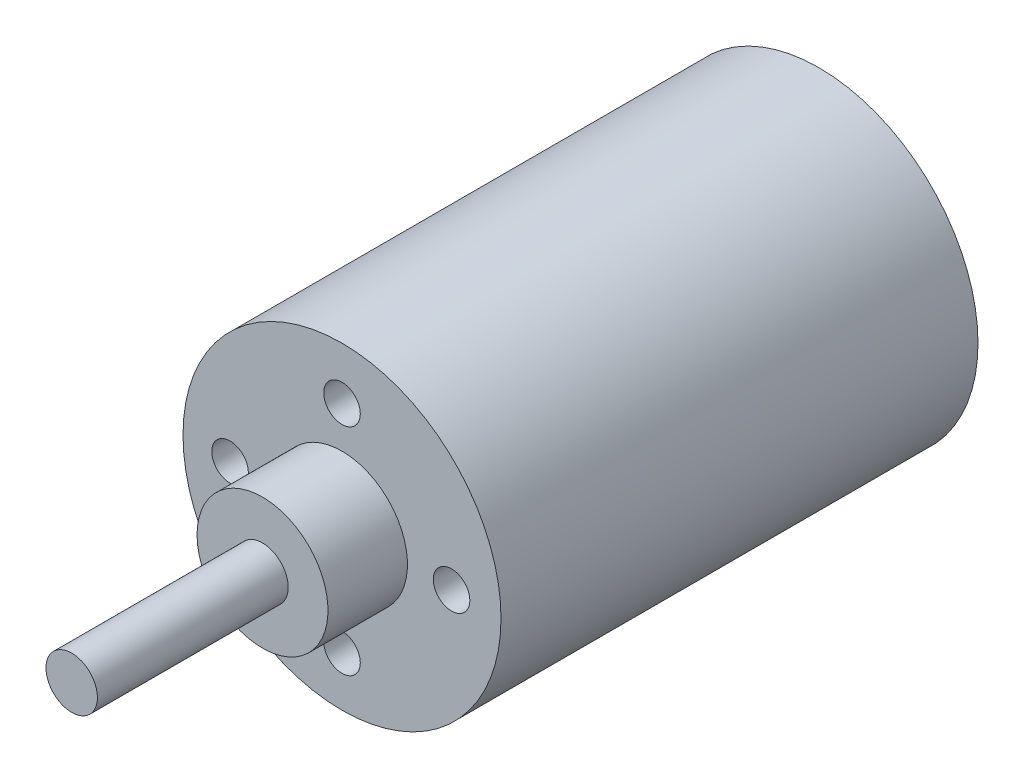
from build123d import *

# Parameters (mm, degrees)
BROCA_DE_ROSQUEAR_PARA_HELICOIDE_M2_21_D     = 2.3
BROCA_DE_ROSQUEAR_PARA_HELICOIDE_M2_21_DEPTH = 3
BROCA_DE_ROSQUEAR_PARA_HELICOIDE_M2_21_TIP   = 0.690989712


with BuildPart() as part:
    # Esboço1 → Revolução1 (revolve)
    with BuildSketch(Plane(origin=(0, 0, 0), x_dir=(0, 0, -1), z_dir=(1, 0, 0)), mode=Mode.PRIVATE) as revolu_o1_sk:
        Polygon((-15, 10), (15, 10), (15, 0), (-32, 0), (-32, 1.616532902), (-20, 1.616532902), (-20, 4.116532902), (-15, 4.116532902), align=None)
    revolve(revolu_o1_sk.sketch.rotate(Axis((0, 0, -15), (0, 0, 1)), 90), axis=Axis((0, 0, -15), (0, 0, 1)))

    # Broca de rosquear para helicoide M2.21
    with Locations(Plane.XY.offset(15)):
        with Locations((0, 6.719156642), (6.889432955, 0), (0, -6.838865025), (-7.041061835, 0)):
            Hole(BROCA_DE_ROSQUEAR_PARA_HELICOIDE_M2_21_D / 2, depth=BROCA_DE_ROSQUEAR_PARA_HELICOIDE_M2_21_DEPTH)
            with Locations((0, 0, -(BROCA_DE_ROSQUEAR_PARA_HELICOIDE_M2_21_DEPTH + BROCA_DE_ROSQUEAR_PARA_HELICOIDE_M2_21_TIP / 2))):  # 118° drill point
                Cone(0, BROCA_DE_ROSQUEAR_PARA_HELICOIDE_M2_21_D / 2, BROCA_DE_ROSQUEAR_PARA_HELICOIDE_M2_21_TIP, mode=Mode.SUBTRACT)


solid = part.part
